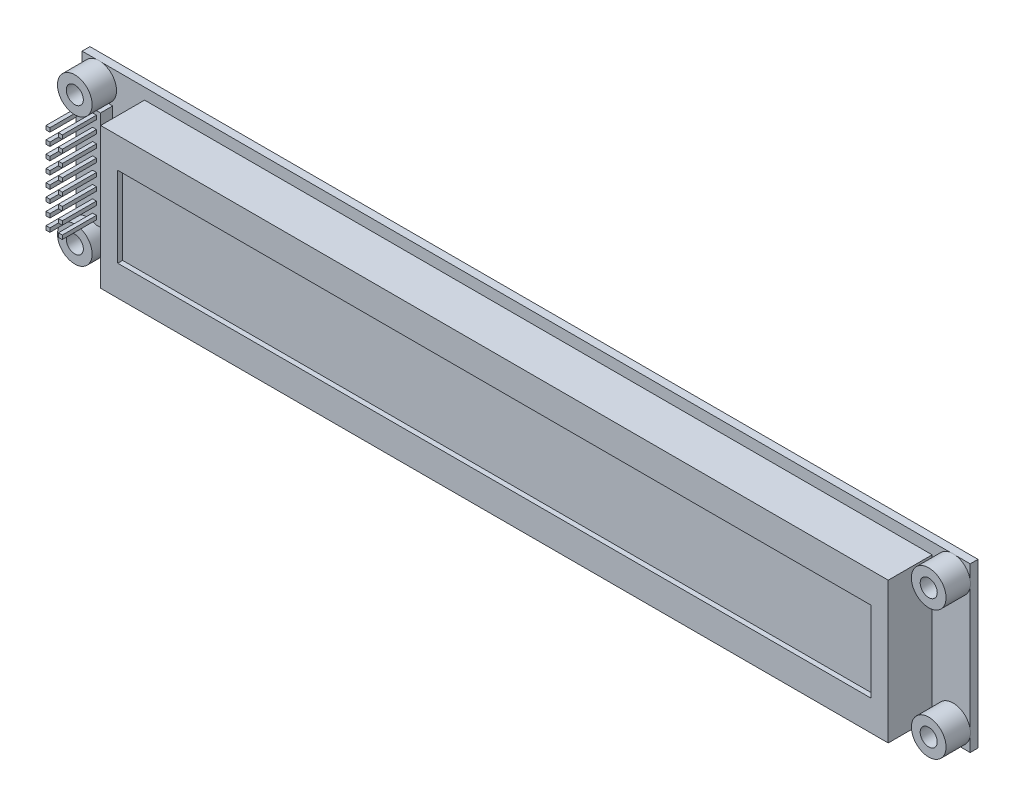
from build123d import *

# Parameters (mm, degrees)
SKETCH_2_W                  = 182
SKETCH_2_H                  = 33.5
EXTRUDE_1_DEPTH             = 1.6
SKETCH_3_W                  = 161.4
SKETCH_3_H                  = 28.9
EXTRUDE_2_DEPTH             = 9
SKETCH_4_W                  = 154.4
SKETCH_4_H                  = 16.5
CUT_EXTRUDE_1_DEPTH         = 1
SKETCH_6_R                  = 3.55
EXTRUDE_3_DEPTH             = 5
CUT_EXTRUDE_2_DEPTH         = 94.023343844
CUT_EXTRUDE_2_DEPTH_BACK    = 94.023343844
SKETCH_5_R                  = 1.75
SKETCH_9_W                  = 5
SKETCH_9_H                  = 20.32
EXTRUDE_5_DEPTH             = 2.5
SKETCH_10_W                 = 0.8
SKETCH_10_H                 = 0.8
EXTRUDE_6_DEPTH             = 7
PATTERN_LINEAR_1_COUNT      = 2
PATTERN_LINEAR_1_PITCH      = 2.54
PATTERN_LINEAR_1_COUNT_DIR2 = 8
PATTERN_LINEAR_1_PITCH_DIR2 = 2.54


with BuildPart() as part:
    # Эскиз2 → Бобышка-Вытянуть1 (new body)
    with BuildSketch(Plane.XY.offset(-6.6)):
        Rectangle(SKETCH_2_W, SKETCH_2_H)
    extrude(amount=EXTRUDE_1_DEPTH)

    # Эскиз3 → Бобышка-Вытянуть2 (add)
    with BuildSketch(Plane.XY.offset(-5)):
        with Locations((2.5, 0)):
            Rectangle(SKETCH_3_W, SKETCH_3_H)
    extrude(amount=EXTRUDE_2_DEPTH)

    # Эскиз4 → Вырез-Вытянуть1 (cut)
    with BuildSketch(Plane.XY.offset(4)):
        with Locations((2.5, 0)):
            Rectangle(SKETCH_4_W, SKETCH_4_H)
    extrude(amount=-CUT_EXTRUDE_1_DEPTH, mode=Mode.SUBTRACT)

    # Эскиз6 → Бобышка-Вытянуть3 (add)
    with BuildSketch(Plane(origin=(0, 0, -5), x_dir=(-1, 0, 0), z_dir=(0, 0, -1))):
        with Locations((-87.5, -13.25)):
            Circle(SKETCH_6_R)
        with Locations((-87.5, 13.25)):
            Circle(SKETCH_6_R)
        with Locations((87.5, 13.25)):
            Circle(SKETCH_6_R)
        with Locations((87.5, -13.25)):
            Circle(SKETCH_6_R)
    extrude(amount=-EXTRUDE_3_DEPTH)

    # Эскиз5 → Вырез-Вытянуть2 (cut, two sides: drawn at the far end of the back side and taken through both)
    with BuildSketch(Plane.XY.offset(-5).offset(-CUT_EXTRUDE_2_DEPTH_BACK)):
        with Locations((-87.5, 13.25)):
            Circle(SKETCH_5_R)
        with Locations((-87.5, -13.25)):
            Circle(SKETCH_5_R)
        with Locations((87.5, -13.25)):
            Circle(SKETCH_5_R)
        with Locations((87.5, 13.25)):
            Circle(SKETCH_5_R)
    extrude(amount=CUT_EXTRUDE_2_DEPTH + CUT_EXTRUDE_2_DEPTH_BACK, mode=Mode.SUBTRACT)

    # Эскиз9 → Бобышка-Вытянуть5 (add)
    with BuildSketch(Plane.XY.offset(-5)):
        with Locations((-87.23, 0)):
            Rectangle(SKETCH_9_W, SKETCH_9_H)
    extrude(amount=EXTRUDE_5_DEPTH)

    # Эскиз10 → Бобышка-Вытянуть6 (add)
    with BuildSketch(Plane.XY.offset(-2.5)):
        with Locations((-88.5, 8.95)):
            Rectangle(SKETCH_10_W, SKETCH_10_H)
    extrude_6 = extrude(amount=EXTRUDE_6_DEPTH)

    # Линейный массив1: Extrude 6 2 × 8
    with Locations(*[(i * PATTERN_LINEAR_1_PITCH, -j * PATTERN_LINEAR_1_PITCH_DIR2, 0) for i in range(PATTERN_LINEAR_1_COUNT) for j in range(PATTERN_LINEAR_1_COUNT_DIR2) if (i, j) != (0, 0)]):
        add(extrude_6)


solid = part.part
